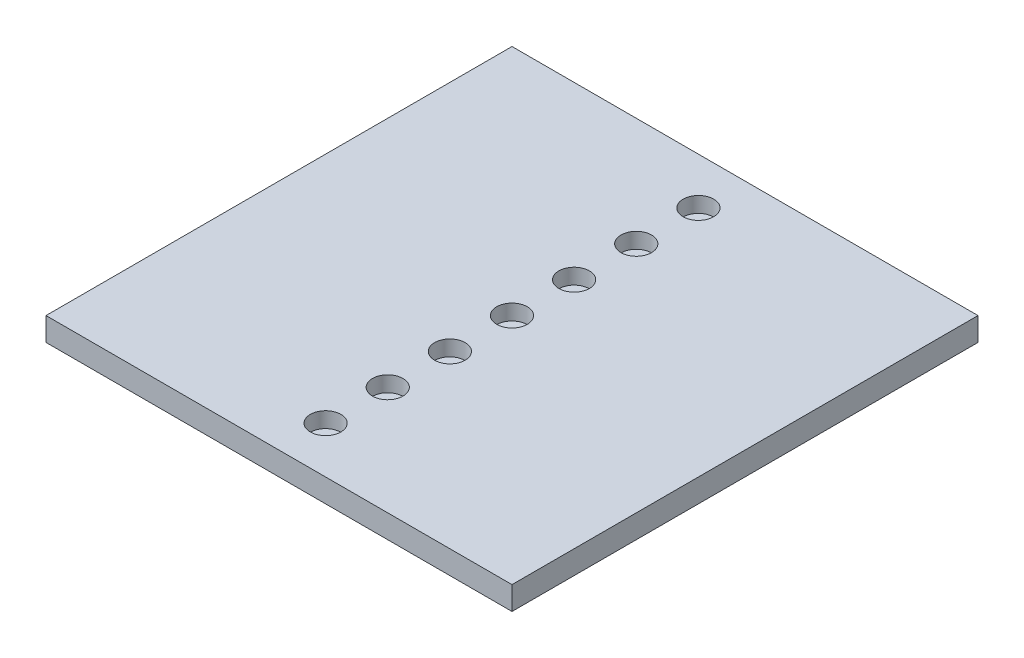
from build123d import *

# Parameters (mm, degrees)
SKETCH2_W         = 381
SKETCH2_H         = 381
SKETCH2_R         = 3.3782
BOLT_HOLES_DEPTH  = 19.05
SKETCH3_R         = 12.5
COUNTERBORE_DEPTH = 12.7


with BuildPart() as part:
    # Sketch2 → Bolt Holes (new body)
    with BuildSketch(Plane(origin=(0, 0, 0), x_dir=(1, 0, 0), z_dir=(0, 1, 0))):
        Rectangle(SKETCH2_W, SKETCH2_H)
        with Locations(Location((0, 0, 0), (0, 0, 90))):
            Circle(SKETCH2_R, mode=Mode.SUBTRACT)
        with Locations(Location((0, 50.8, 0), (0, 0, 90))):
            Circle(SKETCH2_R, mode=Mode.SUBTRACT)
        with Locations(Location((0, 101.6, 0), (0, 0, 90))):
            Circle(SKETCH2_R, mode=Mode.SUBTRACT)
        with Locations(Location((0, 152.4, 0), (0, 0, 90))):
            Circle(SKETCH2_R, mode=Mode.SUBTRACT)
        with Locations(Location((0, -50.8, 0), (0, 0, 90))):
            Circle(SKETCH2_R, mode=Mode.SUBTRACT)
        with Locations(Location((0, -101.6, 0), (0, 0, 90))):
            Circle(SKETCH2_R, mode=Mode.SUBTRACT)
        with Locations(Location((0, -152.4, 0), (0, 0, 90))):
            Circle(SKETCH2_R, mode=Mode.SUBTRACT)
    extrude(amount=BOLT_HOLES_DEPTH)

    # Sketch3 → Counterbore (cut)
    with BuildSketch(Plane(origin=(0, 19.05, 0), x_dir=(1, 0, 0), z_dir=(0, 1, 0))):
        with Locations(Location((0, -50.8, 0), (0, 0, 270))):
            Circle(SKETCH3_R)
        with Locations(Location((0, 0, 0), (0, 0, 270))):
            Circle(SKETCH3_R)
        with Locations(Location((0, -101.6, 0), (0, 0, 270))):
            Circle(SKETCH3_R)
        with Locations(Location((0, 50.8, 0), (0, 0, 270))):
            Circle(SKETCH3_R)
        with Locations(Location((0, 101.6, 0), (0, 0, 270))):
            Circle(SKETCH3_R)
        with Locations(Location((0, 152.4, 0), (0, 0, 270))):
            Circle(SKETCH3_R)
        with Locations(Location((0, -152.4, 0), (0, 0, 270))):
            Circle(SKETCH3_R)
    extrude(amount=-COUNTERBORE_DEPTH, mode=Mode.SUBTRACT)


solid = part.part
